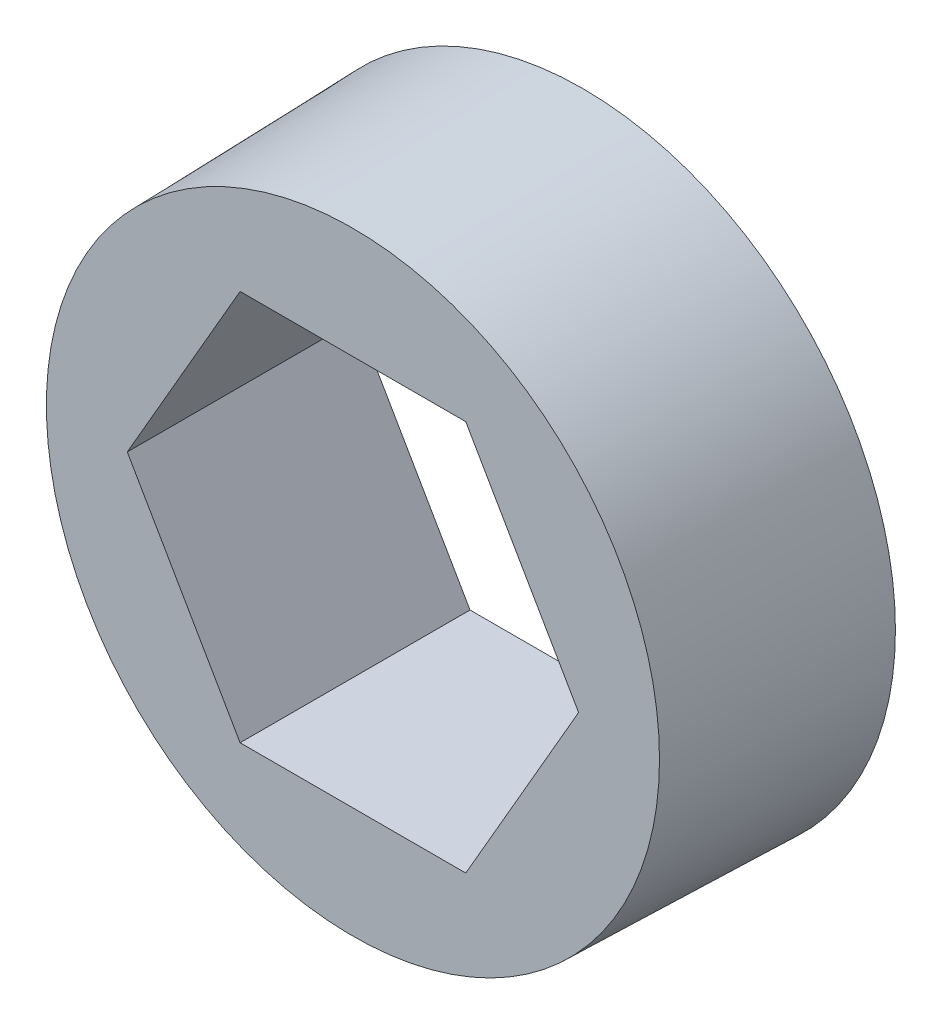
from build123d import *

# Parameters (mm, degrees)
CUT_EXTRUDE1_DEPTH = 7.501481899


with BuildPart() as part:
    # Sketch1 → Revolve1 (revolve)
    with BuildSketch(Plane(origin=(0, 0, 0), x_dir=(1, 0, 0), z_dir=(0, 1, 0))):
        Polygon((4.078557765, 1.5), (0, 1.5), (0, -1.5), (4, -1.5), align=None)
    revolve(axis=Axis((0, 0, -1.5), (0, 0, 1)))

    # Sketch2 → Cut-Extrude1 (cut, through all)
    with BuildSketch(Plane(origin=(0, 0, -1.5), x_dir=(-1, 0, 0), z_dir=(0, 0, -1))):
        Polygon((-2.944486373, 0), (-1.472243186, -2.55), (1.472243186, -2.55), (2.944486373, 0), (1.472243186, 2.55), (-1.472243186, 2.55), align=None)
    extrude(amount=-CUT_EXTRUDE1_DEPTH, mode=Mode.SUBTRACT)


solid = part.part
